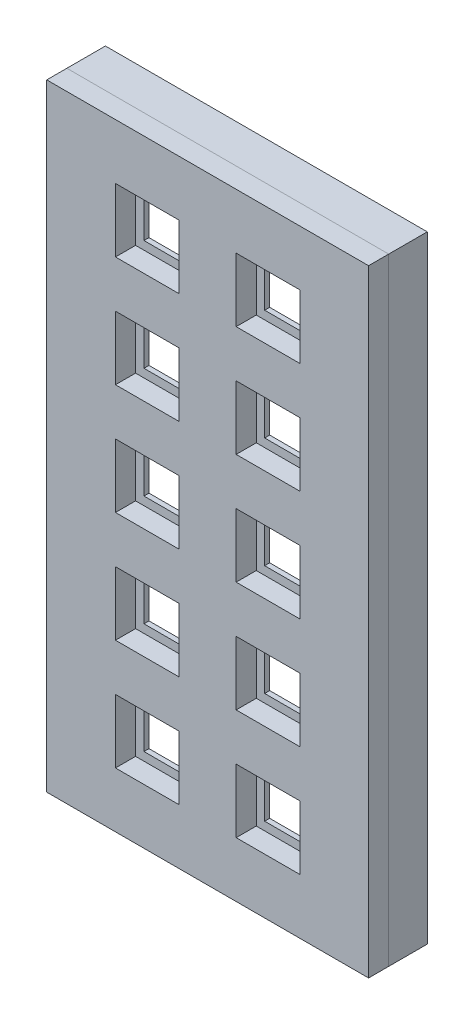
from build123d import *

# Parameters (mm, degrees)
SKETCH1_W           = 184
SKETCH1_H           = 96
BOSS_EXTRUDE1_DEPTH = 1.5
SKETCH2_W           = 14
SKETCH2_H           = 14
CUT_EXTRUDE1_DEPTH  = 1.5
SKETCH3_W           = 96
SKETCH3_H           = 184
SKETCH3_W_2         = 19
SKETCH3_H_2         = 19
UP_COVER_DEPTH      = 6
SKETCH4_W           = 96
SKETCH4_H           = 184
SKETCH4_W_2         = 90
SKETCH4_H_2         = 178
BOSS_EXTRUDE3_DEPTH = 10


with BuildPart() as part:
    # Sketch1 → Boss-Extrude1 (new body)
    with BuildSketch(Plane(origin=(0, 0, 0), x_dir=(0, 1, 0), z_dir=(0, 0, 1))):
        with Locations((92, 48)):
            Rectangle(SKETCH1_W, SKETCH1_H)
    extrude(amount=BOSS_EXTRUDE1_DEPTH)

    # Sketch2 → Cut-Extrude1 (cut)
    with BuildSketch(Plane.XY.offset(1.5)):
        with Locations((-66, 59)):
            Rectangle(SKETCH2_W, SKETCH2_H)
        with Locations((-66, 92)):
            Rectangle(SKETCH2_W, SKETCH2_H)
        with Locations((-66, 26)):
            Rectangle(SKETCH2_W, SKETCH2_H)
        with Locations((-66, 125)):
            Rectangle(SKETCH2_W, SKETCH2_H)
        with Locations((-66, 158)):
            Rectangle(SKETCH2_W, SKETCH2_H)
        with Locations((-30, 92)):
            Rectangle(SKETCH2_W, SKETCH2_H)
        with Locations((-30, 59)):
            Rectangle(SKETCH2_W, SKETCH2_H)
        with Locations((-30, 26)):
            Rectangle(SKETCH2_W, SKETCH2_H)
        with Locations((-30, 158)):
            Rectangle(SKETCH2_W, SKETCH2_H)
        with Locations((-30, 125)):
            Rectangle(SKETCH2_W, SKETCH2_H)
    extrude(amount=-CUT_EXTRUDE1_DEPTH, mode=Mode.SUBTRACT)

    # Sketch4 → Boss-Extrude3 (add)
    with BuildSketch(Plane(origin=(0, 0, 0), x_dir=(1, 0, 0), z_dir=(0, 0, -1))):
        with Locations((-48, -92)):
            Rectangle(SKETCH4_W, SKETCH4_H)
        with Locations((-48, -92)):
            Rectangle(SKETCH4_W_2, SKETCH4_H_2, mode=Mode.SUBTRACT)
    extrude(amount=BOSS_EXTRUDE3_DEPTH)


with BuildPart() as body_2:
    # Sketch3 → up-cover (new body)
    with BuildSketch(Plane.XY.offset(1.5)):
        with Locations((-48, 92)):
            Rectangle(SKETCH3_W, SKETCH3_H)
        with Locations((-66, 158)):
            Rectangle(SKETCH3_W_2, SKETCH3_H_2, mode=Mode.SUBTRACT)
        with Locations((-30, 158)):
            Rectangle(SKETCH3_W_2, SKETCH3_H_2, mode=Mode.SUBTRACT)
        with Locations((-30, 125)):
            Rectangle(SKETCH3_W_2, SKETCH3_H_2, mode=Mode.SUBTRACT)
        with Locations((-30, 92)):
            Rectangle(SKETCH3_W_2, SKETCH3_H_2, mode=Mode.SUBTRACT)
        with Locations((-30, 59)):
            Rectangle(SKETCH3_W_2, SKETCH3_H_2, mode=Mode.SUBTRACT)
        with Locations((-30, 26)):
            Rectangle(SKETCH3_W_2, SKETCH3_H_2, mode=Mode.SUBTRACT)
        with Locations((-66, 125)):
            Rectangle(SKETCH3_W_2, SKETCH3_H_2, mode=Mode.SUBTRACT)
        with Locations((-66, 92)):
            Rectangle(SKETCH3_W_2, SKETCH3_H_2, mode=Mode.SUBTRACT)
        with Locations((-66, 59)):
            Rectangle(SKETCH3_W_2, SKETCH3_H_2, mode=Mode.SUBTRACT)
        with Locations((-66, 26)):
            Rectangle(SKETCH3_W_2, SKETCH3_H_2, mode=Mode.SUBTRACT)
    extrude(amount=UP_COVER_DEPTH)


solid = Compound([part.part, body_2.part])
